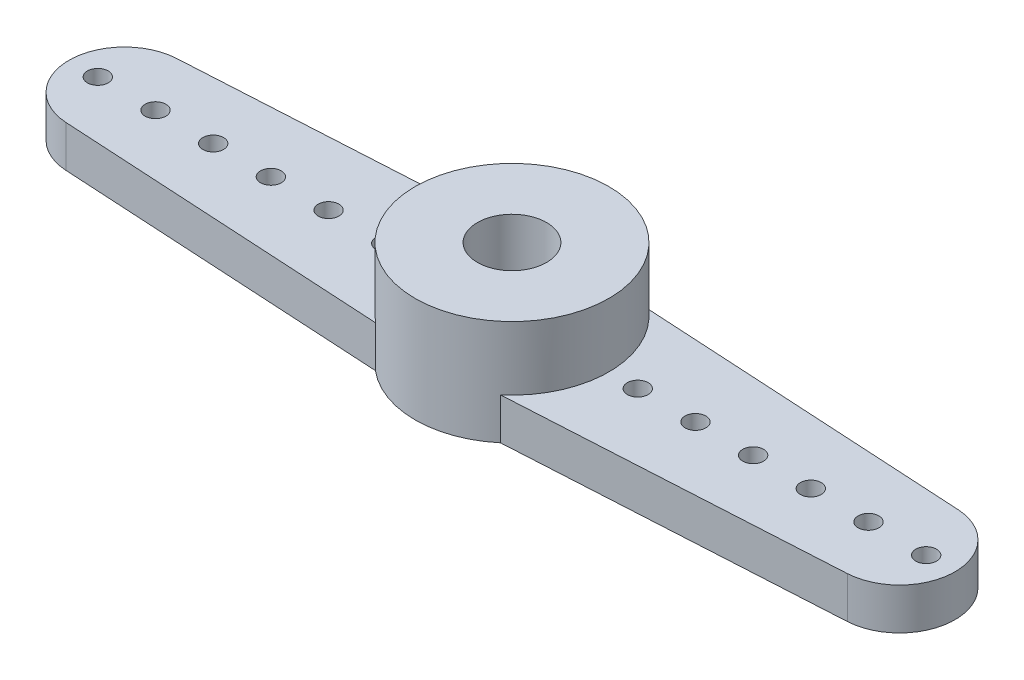
from build123d import *
from build123d.topology import SkipClean

# Parameters (mm, degrees)
BOSS_EXTRUDE1_DEPTH = 1.5
SKETCH2_R           = 3.5
BOSS_EXTRUDE2_DEPTH = 2.3
SKETCH3_R           = 0.375
SKETCH3_R_2         = 1.25
CUT_EXTRUDE1_DEPTH  = 17.539044712


with BuildPart() as part:
    # Sketch1 → Boss-Extrude1 (new body)
    with BuildSketch(Plane(origin=(0, 0, 0), x_dir=(1, 0, 0), z_dir=(0, 1, 0))):
        with BuildLine():
            Line((2.257072219, 2.675), (14.110649579, 2))
            ThreePointArc((14.110649579, 2), (16, 0), (14.110649579, -2))
            Line((14.110649579, -2), (2.257072219, -2.675))
            ThreePointArc((2.257072219, -2.675), (-3.5, 0), (2.257072219, 2.675))
        make_face()
    boss_extrude1 = extrude(amount=BOSS_EXTRUDE1_DEPTH)

    # Sketch2 → Boss-Extrude2 (add)
    with SkipClean():  # the faces are left unmerged after this step: merging them gives an invalid solid
        with BuildSketch(Plane(origin=(0, 1.5, 0), x_dir=(1, 0, 0), z_dir=(0, 1, 0))):
            with Locations(Location((0, 0, 0), (0, 0, 49.843487791))):
                Circle(SKETCH2_R)
        extrude(amount=BOSS_EXTRUDE2_DEPTH)

    # Sketch3 → Cut-Extrude1 (cut, symmetric)
    with SkipClean():  # the faces are left unmerged after this step: merging them gives an invalid solid
        with BuildSketch(Plane(origin=(0, 1.5, 0), x_dir=(1, 0, 0), z_dir=(0, 1, 0))):
            with Locations(Location((14.958333333, 0, 0), (0, 0, 270))):
                Circle(SKETCH3_R)
            with Locations(Location((12.875, 0, 0), (0, 0, 270))):
                Circle(SKETCH3_R)
            with Locations(Location((10.791666667, 0, 0), (0, 0, 270))):
                Circle(SKETCH3_R)
            with Locations(Location((8.708333333, 0, 0), (0, 0, 270))):
                Circle(SKETCH3_R)
            with Locations(Location((6.625, 0, 0), (0, 0, 270))):
                Circle(SKETCH3_R)
            with Locations(Location((4.541666667, 0, 0), (0, 0, 270))):
                Circle(SKETCH3_R)
            with Locations(Location((0, 0, 0), (0, 0, 270))):
                Circle(SKETCH3_R_2)
        cut_extrude1 = extrude(amount=CUT_EXTRUDE1_DEPTH, both=True, mode=Mode.SUBTRACT)

    # Mirror1: Boss-Extrude1, Cut-Extrude1 across plane
    with SkipClean():  # the faces are left unmerged after this step: merging them gives an invalid solid
        add(boss_extrude1.mirror(Plane(origin=(0, 0, 0), x_dir=(0, 0, 1), z_dir=(1, 0, 0))))
        add(cut_extrude1.mirror(Plane(origin=(0, 0, 0), x_dir=(0, 0, 1), z_dir=(1, 0, 0))), mode=Mode.SUBTRACT)


solid = part.part
